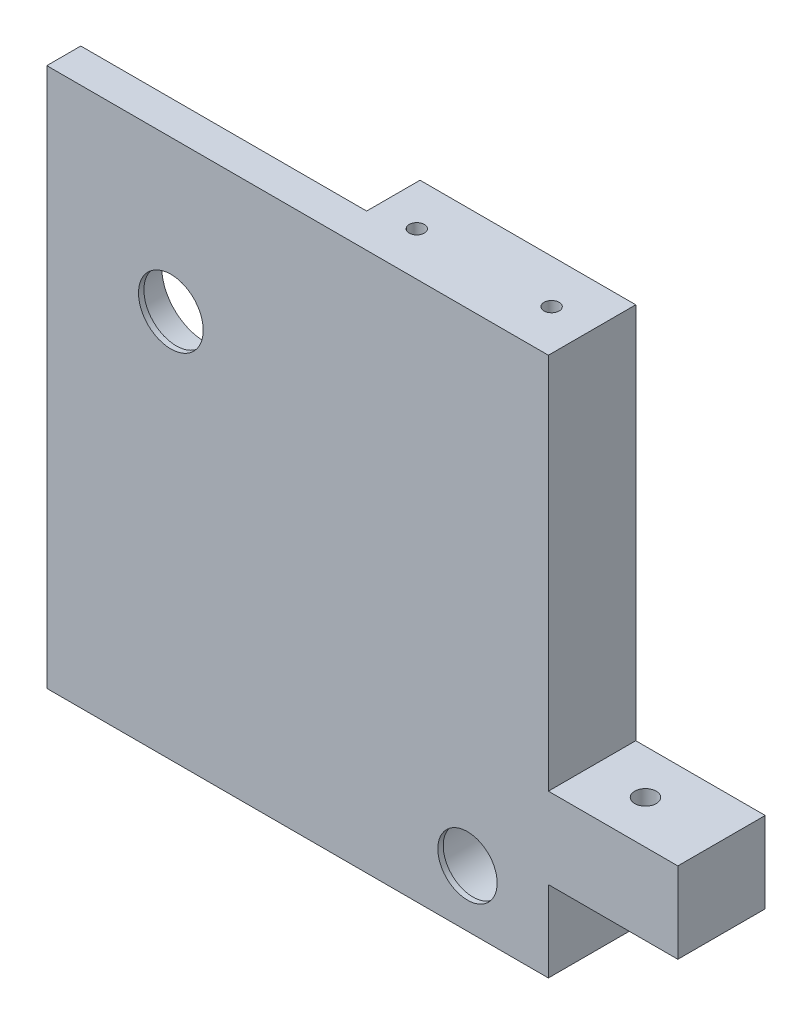
from build123d import *

# Parameters (mm, degrees)
SKETCH1_W           = 93
SKETCH1_H           = 100
BOSS_EXTRUDE2_DEPTH = 6.3
SKETCH3_W           = 40
SKETCH3_H           = 100
BOSS_EXTRUDE3_DEPTH = 9.9
SKETCH4_W           = 16.2
SKETCH4_H           = 15
BOSS_EXTRUDE4_DEPTH = 24
SKETCH5_R           = 2
CUT_EXTRUDE1_DEPTH  = 50
SKETCH6_R           = 7.5
CUT_EXTRUDE2_DEPTH  = 50
SKETCH7_R           = 8
CUT_EXTRUDE3_DEPTH  = 50
EXTRUDE_THIN1_START = -5.3
SKETCH7_2_R         = 8
SKETCH7_2_R_2       = 6
EXTRUDE_THIN1_DEPTH = 1
EXTRUDE_THIN2_START = -15.2
SKETCH6_2_R         = 7.5
SKETCH6_2_R_2       = 5.5
EXTRUDE_THIN2_DEPTH = 1
SKETCH8_R           = 1.4
CUT_EXTRUDE4_DEPTH  = 20


with BuildPart() as part:
    # Sketch1 → Boss-Extrude2 (new body)
    with BuildSketch(Plane.XY):
        with Locations((-29.68705036, 14.928057554)):
            Rectangle(SKETCH1_W, SKETCH1_H)
    extrude(amount=BOSS_EXTRUDE2_DEPTH)

    # Sketch3 → Boss-Extrude3 (add)
    with BuildSketch(Plane(origin=(0, 0, 0), x_dir=(-1, 0, 0), z_dir=(0, 0, -1))):
        with Locations((3.18705036, 14.928057554)):
            Rectangle(SKETCH3_W, SKETCH3_H)
    extrude(amount=BOSS_EXTRUDE3_DEPTH)

    # Sketch4 → Boss-Extrude4 (add)
    with BuildSketch(Plane(origin=(16.81294964, 0, 0), x_dir=(0, 0, -1), z_dir=(1, 0, 0))):
        with Locations((1.8, -12.571942446)):
            Rectangle(SKETCH4_W, SKETCH4_H)
    extrude(amount=BOSS_EXTRUDE4_DEPTH)

    # Sketch5 → Cut-Extrude1 (cut)
    with BuildSketch(Plane(origin=(0, -5.071942446, 0), x_dir=(1, 0, 0), z_dir=(0, 1, 0))):
        with Locations(Location((26.81294964, 1.7, 0), (0, 0, 180))):
            Circle(SKETCH5_R)
    extrude(amount=-CUT_EXTRUDE1_DEPTH, mode=Mode.SUBTRACT)

    # Sketch6 → Cut-Extrude2 (cut)
    with BuildSketch(Plane(origin=(0, 0, -9.9), x_dir=(-1, 0, 0), z_dir=(0, 0, -1))):
        with Locations((-1.81294964, -24.571942446)):
            Circle(SKETCH6_R)
    extrude(amount=-CUT_EXTRUDE2_DEPTH, mode=Mode.SUBTRACT)

    # Sketch7 → Cut-Extrude3 (cut)
    with BuildSketch(Plane(origin=(0, 0, 0), x_dir=(-1, 0, 0), z_dir=(0, 0, -1))):
        with Locations((53.18705036, 36.928057554)):
            Circle(SKETCH7_R)
    extrude(amount=-CUT_EXTRUDE3_DEPTH, mode=Mode.SUBTRACT)

    # Sketch7<2> → Extrude-Thin1 (add)
    with BuildSketch(Plane(origin=(0, 0, 0), x_dir=(-1, 0, 0), z_dir=(0, 0, -1)).offset(EXTRUDE_THIN1_START)):
        with Locations((53.18705036, 36.928057554)):
            Circle(SKETCH7_2_R)
        with Locations((53.18705036, 36.928057554)):
            Circle(SKETCH7_2_R_2, mode=Mode.SUBTRACT)
    extrude(amount=-EXTRUDE_THIN1_DEPTH)

    # Sketch6<2> → Extrude-Thin2 (add)
    with BuildSketch(Plane(origin=(0, 0, -9.9), x_dir=(-1, 0, 0), z_dir=(0, 0, -1)).offset(EXTRUDE_THIN2_START)):
        with Locations((-1.81294964, -24.571942446)):
            Circle(SKETCH6_2_R)
        with Locations((-1.81294964, -24.571942446)):
            Circle(SKETCH6_2_R_2, mode=Mode.SUBTRACT)
    extrude(amount=-EXTRUDE_THIN2_DEPTH)

    # Sketch8 → Cut-Extrude4 (cut)
    with BuildSketch(Plane(origin=(0, 64.928057554, 0), x_dir=(1, 0, 0), z_dir=(0, 1, 0))):
        with Locations(Location((-15.68705036, 1.8, 0), (0, 0, 270))):
            Circle(SKETCH8_R)
        with Locations(Location((9.31294964, 1.8, 0), (0, 0, 270))):
            Circle(SKETCH8_R)
    extrude(amount=-CUT_EXTRUDE4_DEPTH, mode=Mode.SUBTRACT)


solid = part.part
